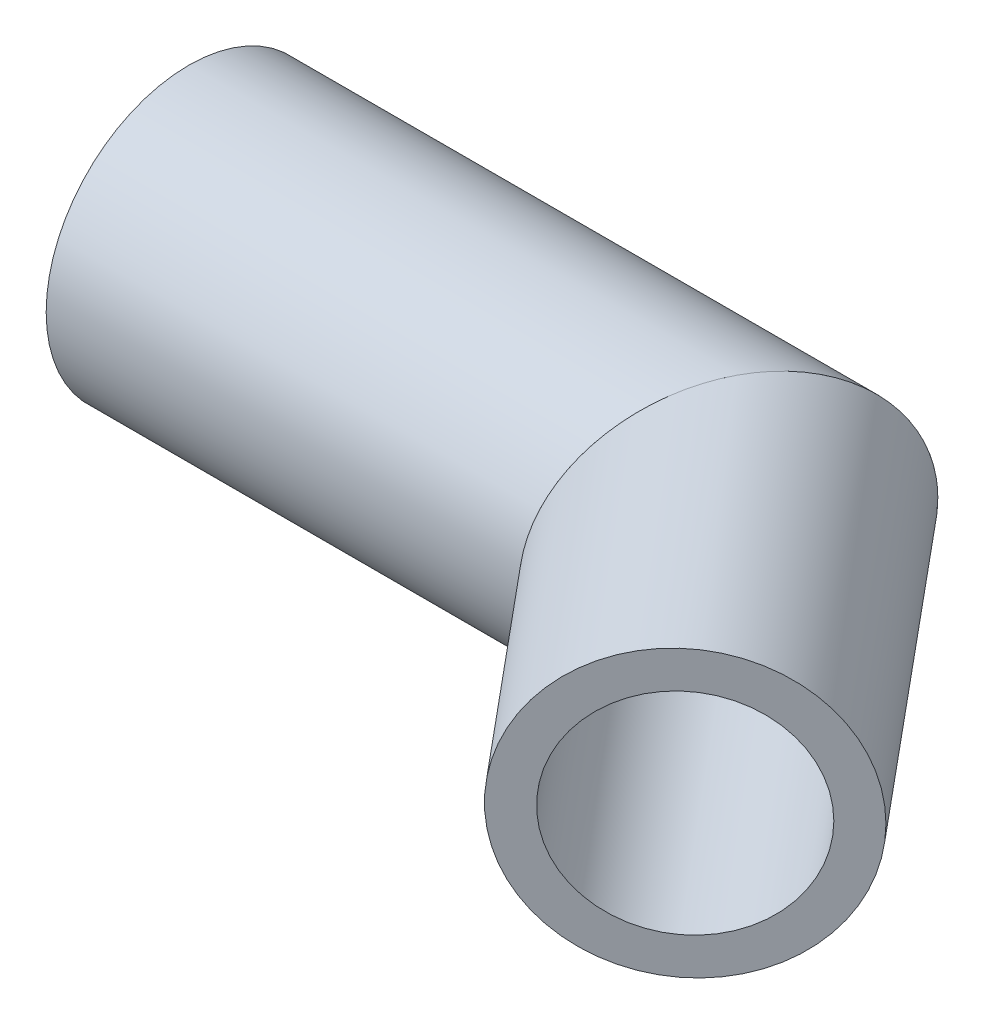
from build123d import *

# Parameters (mm, degrees)
SKETCH11_R                = 10.668
SKETCH11_R_2              = 7.8994
PIPE_0_5_SCH_40_1_DEPTH   = 48.464216718
SKETCH11_ON_SEGMENT_2_R   = 10.668
SKETCH11_ON_SEGMENT_2_R_2 = 7.8994
PIPE_0_5_SCH_40_1_2_DEPTH = 33.075216718


with BuildPart() as part:
    # Sketch11 → Pipe 0.5 SCH 40(1) (new body)
    with BuildSketch(Plane(origin=(0, 0, 0), x_dir=(0, 0, -1), z_dir=(1, 0, 0))):
        Circle(SKETCH11_R)
        Circle(SKETCH11_R_2, mode=Mode.SUBTRACT)
    extrude(amount=PIPE_0_5_SCH_40_1_DEPTH)

    # Pipe 0.5 SCH 40(1) mitre 1
    split(bisect_by=Plane(origin=(40.389, 0, 0), x_dir=(0, -1, 0), z_dir=(-0.905383621, 0, -0.424594511)), keep=Keep.TOP)


with BuildPart() as body_2:
    # Sketch11 on segment 2 (carried to segment 2) → Pipe 0.5 SCH 40_1 2 (new body)
    with BuildSketch(Plane(origin=(35.225391481, 0, -6.208564416), x_dir=(0.768841832, 0, -0.639439002), z_dir=(0.639439002, 0, 0.768841832))):
        Circle(SKETCH11_ON_SEGMENT_2_R)
        Circle(SKETCH11_ON_SEGMENT_2_R_2, mode=Mode.SUBTRACT)
    extrude(amount=PIPE_0_5_SCH_40_1_2_DEPTH)

    # Pipe 0.5 SCH 40_1 2 mitre 1
    split(bisect_by=Plane(origin=(40.389, 0, 0), x_dir=(0, 1, 0), z_dir=(0.905383621, 0, 0.424594511)), keep=Keep.TOP)


solid = Compound([part.part, body_2.part])
